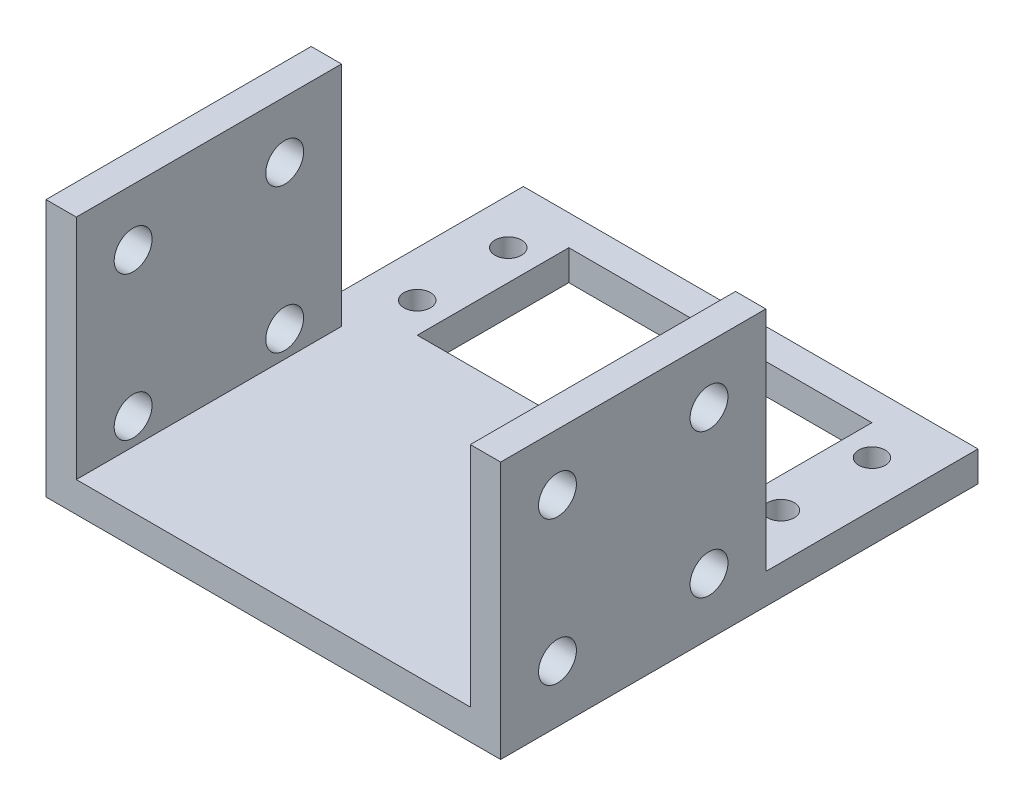
from build123d import *

# Parameters (mm, degrees)
SKETCH_1_R          = 1.75
SKETCH_1_W          = 40
SKETCH_1_H          = 20
EXTRUDE_1_DEPTH     = 4
SKETCH_1_3_W        = 4
SKETCH_1_3_H        = 35
EXTRUDE_2_DEPTH     = 34
SKETCH_2_R          = 2.5
CUT_EXTRUDE_1_DEPTH = 85.599054368


with BuildPart() as part:
    # 草图1 → 凸台-拉伸1 (new body)
    with BuildSketch(Plane(origin=(0, 0, 0), x_dir=(1, 0, 0), z_dir=(0, 1, 0))):
        Polygon((30, 14), (-30, 14), (-30, -14), (-26, -14), (-26, -49), (26, -49), (26, -14), (30, -14), align=None)
        with Locations((-24, -6.007090491)):
            Circle(SKETCH_1_R, mode=Mode.SUBTRACT)
        with Locations((-24, 6.007090491)):
            Circle(SKETCH_1_R, mode=Mode.SUBTRACT)
        Rectangle(SKETCH_1_W, SKETCH_1_H, mode=Mode.SUBTRACT)
        with Locations((24, -6.007090491)):
            Circle(SKETCH_1_R, mode=Mode.SUBTRACT)
        with Locations((24, 6.007090491)):
            Circle(SKETCH_1_R, mode=Mode.SUBTRACT)
    extrude(amount=EXTRUDE_1_DEPTH)

    # 草图1<3> → 凸台-拉伸2 (add)
    with BuildSketch(Plane(origin=(0, 0, 0), x_dir=(1, 0, 0), z_dir=(0, 1, 0))):
        with Locations((-28, -31.5)):
            Rectangle(SKETCH_1_3_W, SKETCH_1_3_H)
        with Locations((28, -31.5)):
            Rectangle(SKETCH_1_3_W, SKETCH_1_3_H)
    extrude(amount=EXTRUDE_2_DEPTH)

    # 草图2 → 切除-拉伸1 (cut, through all)
    with BuildSketch(Plane(origin=(30, 0, 0), x_dir=(0, 0, -1), z_dir=(1, 0, 0))):
        with Locations((-41.5, 26.5)):
            Circle(SKETCH_2_R)
        with Locations((-21.5, 26.5)):
            Circle(SKETCH_2_R)
        with Locations((-21.5, 7.5)):
            Circle(SKETCH_2_R)
        with Locations((-41.5, 7.5)):
            Circle(SKETCH_2_R)
    extrude(amount=-CUT_EXTRUDE_1_DEPTH, mode=Mode.SUBTRACT)


solid = part.part
